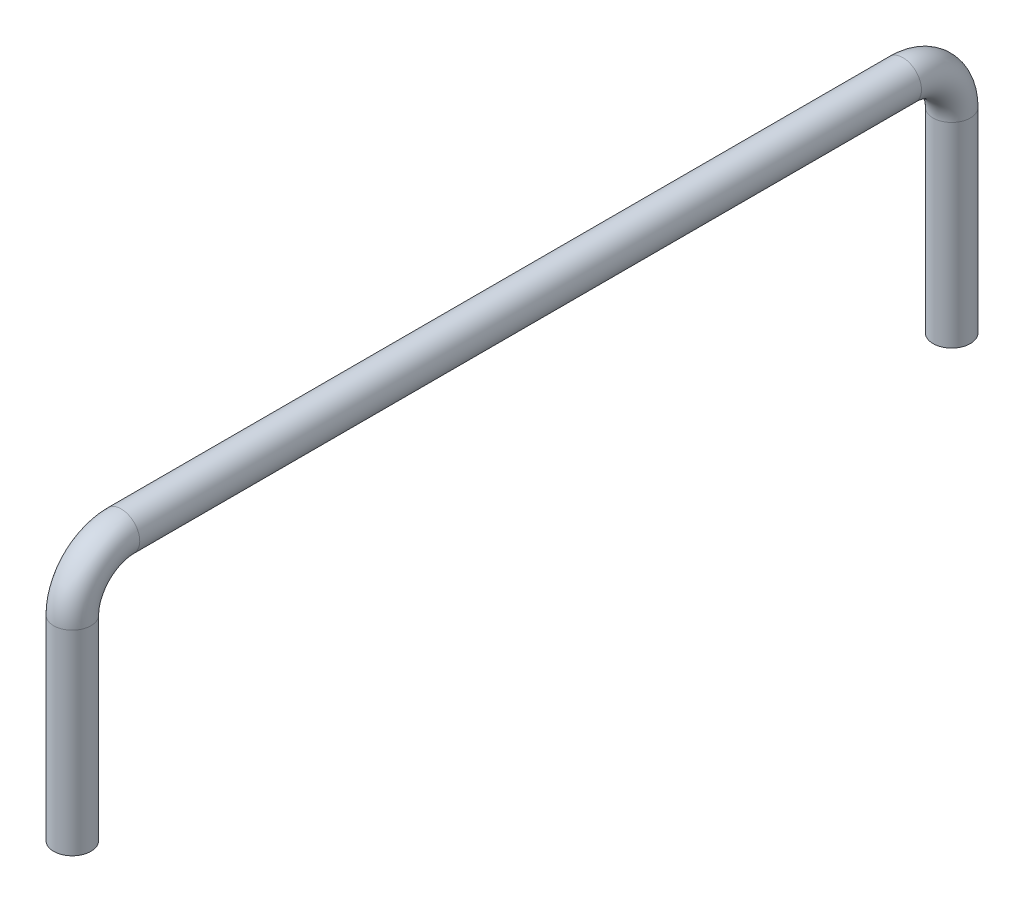
from build123d import *

# Parameters (mm, degrees)
SKETCH2_R = 0.381


with BuildPart() as part:
    # Sweep1: sweep along a path in Sketch3
    with BuildLine(Plane(origin=(0, 0, 0), x_dir=(0, 0, -1), z_dir=(1, 0, 0))) as sweep1_path:
        Line((0, 0), (0, 4))
        ThreePointArc((0, 4), (0.292893219, 4.707106781), (1, 5))
        Line((1, 5), (17, 5))
        ThreePointArc((17, 5), (17.707106781, 4.707106781), (18, 4))
        Line((18, 4), (18, 0))
    # Sketch2 → Sweep1 (sweep)
    with BuildSketch(Plane(origin=(0, 0, 0), x_dir=(1, 0, 0), z_dir=(0, 1, 0))):
        Circle(SKETCH2_R)
    sweep(path=sweep1_path.line)


solid = part.part
